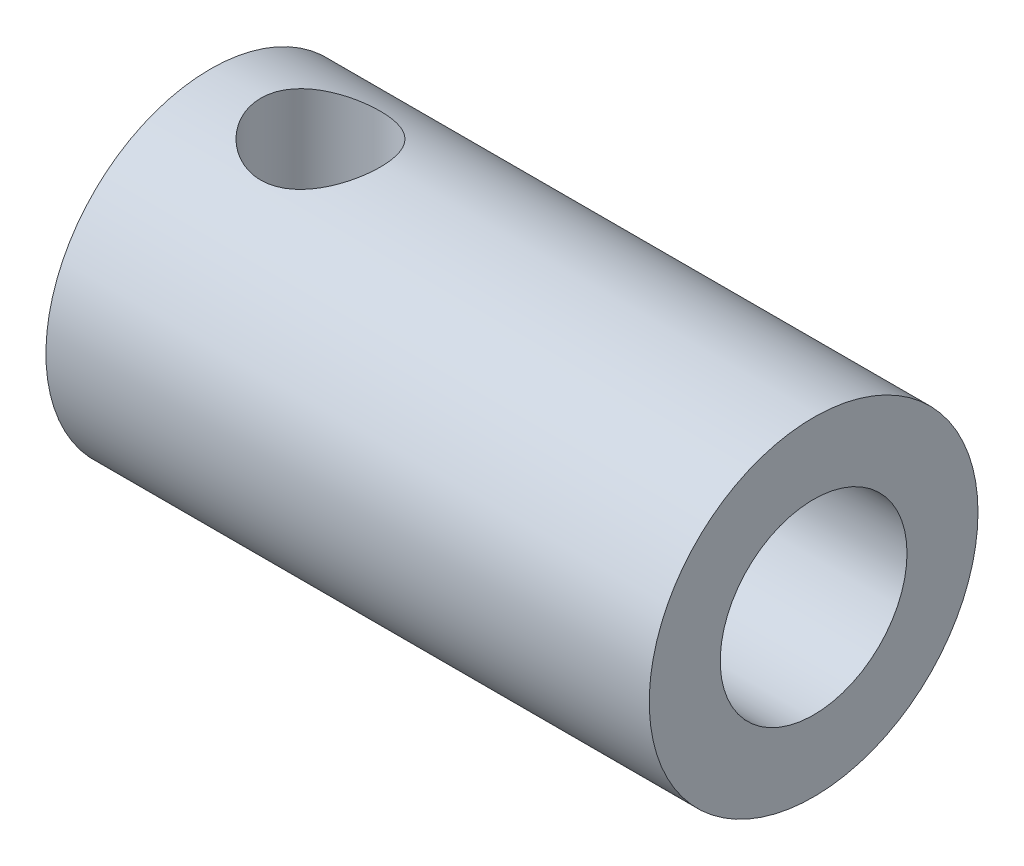
from build123d import *

# Parameters (mm, degrees)
M14X1_5_1_D              = 12.5
M14X1_5_1_DEPTH          = 24
M14X1_5_1_TIP            = 3.755378869
CUT_EXTRUDE_1_DEPTH      = 45.788391353
CUT_EXTRUDE_1_DEPTH_BACK = 45.788391353
SKETCH_4_R               = 4


with BuildPart() as part:
    # 草图1 → 旋转1 (revolve)
    with BuildSketch(Plane.XY, mode=Mode.PRIVATE) as revolve_1_sk:
        with BuildLine():
            Line((0, 0), (0, 11))
            Line((0, 11), (-40.373066959, 11))
            ThreePointArc((-40.373066959, 11), (-41.591066388, 5.559831632), (-42, 0))
            Line((-42, 0), (0, 0))
        make_face()
    revolve(revolve_1_sk.sketch.rotate(Axis((0, 0, 0), (-1, 0, 0)), 90), axis=Axis((0, 0, 0), (-1, 0, 0)))

    # M14X1.5 螺纹孔的螺纹孔钻头1
    with Locations(Plane(origin=(0, 0, 0), x_dir=(0, 0, -1), z_dir=(1, 0, 0))):
        with Locations((0, 0)):
            Hole(M14X1_5_1_D / 2, depth=M14X1_5_1_DEPTH)
            with Locations((0, 0, -(M14X1_5_1_DEPTH + M14X1_5_1_TIP / 2))):  # 118° drill point
                Cone(0, M14X1_5_1_D / 2, M14X1_5_1_TIP, mode=Mode.SUBTRACT)

    # 草图4 → 切除-拉伸1 (cut, two sides: drawn at the far end of the back side and taken through both)
    with BuildSketch(Plane(origin=(0, 0, 0), x_dir=(1, 0, 0), z_dir=(0, 1, 0)).offset(-CUT_EXTRUDE_1_DEPTH_BACK)):
        with Locations(Location((-33, 0, 0), (0, 0, 270))):
            Circle(SKETCH_4_R)
    extrude(amount=CUT_EXTRUDE_1_DEPTH + CUT_EXTRUDE_1_DEPTH_BACK, mode=Mode.SUBTRACT)


solid = part.part
